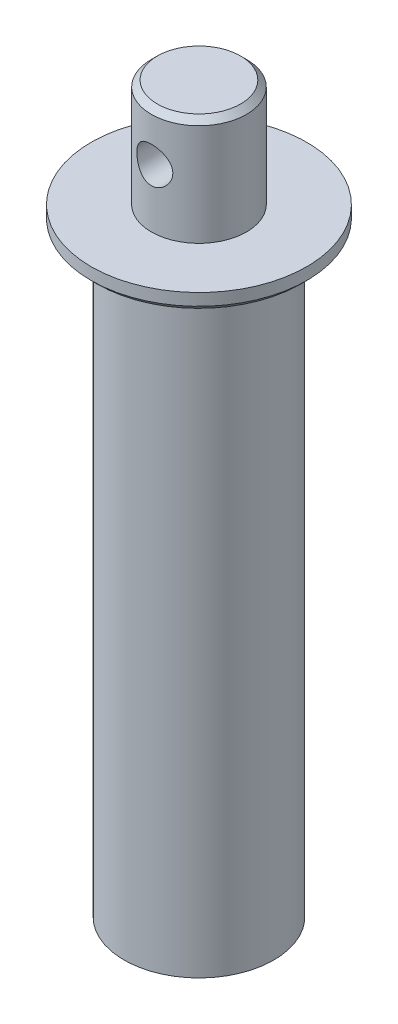
from build123d import *

# Parameters (mm, degrees)
SKETCH_1_R               = 7.95
EXTRUDE_1_DEPTH          = 18
CHAMFER_2_SIZE           = 1
SKETCH_4_R               = 18
EXTRUDE_2_DEPTH          = 3
CHAMFER_1_SIZE           = 1
SKETCH_5_R               = 12.5
EXTRUDE_3_DEPTH          = 100
CUT_EXTRUDE_2_DEPTH      = 107.099010363
CUT_EXTRUDE_2_DEPTH_BACK = 107.099010363
SKETCH_9_R               = 3
CUT_EXTRUDE_START        = 100
SKETCH_10_R              = 7.95
CUT_EXTRUDE_3_DEPTH      = 90


with BuildPart() as part:
    # 草图1 → 凸台-拉伸1 (new body)
    with BuildSketch(Plane(origin=(0, 0, 0), x_dir=(1, 0, 0), z_dir=(0, 1, 0))):
        with Locations(Location((0, 0, 0), (0, 0, 270))):
            Circle(SKETCH_1_R)
    extrude(amount=EXTRUDE_1_DEPTH)

    # 倒角2
    chamfer_2_edges = [part.edges().sort_by_distance(p)[0] for p in [
        (0, 18, -7.95),
    ]]
    chamfer(chamfer_2_edges, length=CHAMFER_2_SIZE)

    # 草图4 → 凸台-拉伸2 (add)
    with BuildSketch(Plane(origin=(0, 0, 0), x_dir=(1, 0, 0), z_dir=(0, 1, 0))):
        with Locations(Location((0, 0, 0), (0, 0, 270))):
            Circle(SKETCH_4_R)
    extrude(amount=-EXTRUDE_2_DEPTH)

    # 倒角1
    chamfer_1_edges = [part.edges().sort_by_distance(p)[0] for p in [
        (0, -3, -18),
    ]]
    chamfer(chamfer_1_edges, length=CHAMFER_1_SIZE)

    # 草图5 → 凸台-拉伸3 (add)
    with BuildSketch(Plane(origin=(0, -3, 0), x_dir=(-1, 0, 0), z_dir=(0, -1, 0))):
        with Locations(Location((0, 0, 0), (0, 0, 90))):
            Circle(SKETCH_5_R)
    extrude(amount=EXTRUDE_3_DEPTH)

    # 草图9 → 切除-拉伸2 (cut, two sides: drawn at the far end of the back side and taken through both)
    with BuildSketch(Plane.XY.offset(-CUT_EXTRUDE_2_DEPTH_BACK)):
        with Locations(Location((0, 9.7, 0), (0, 0, 89.999999999))):
            Circle(SKETCH_9_R)
    extrude(amount=CUT_EXTRUDE_2_DEPTH + CUT_EXTRUDE_2_DEPTH_BACK, mode=Mode.SUBTRACT)

    # 草图10 → 切除-拉伸3 (cut)
    with BuildSketch(Plane(origin=(0, -3, 0), x_dir=(-1, 0, 0), z_dir=(0, -1, 0)).offset(CUT_EXTRUDE_START)):
        with Locations(Location((0, 0, 0), (0, 0, 270))):
            Circle(SKETCH_10_R)
    extrude(amount=-CUT_EXTRUDE_3_DEPTH, mode=Mode.SUBTRACT)


solid = part.part
